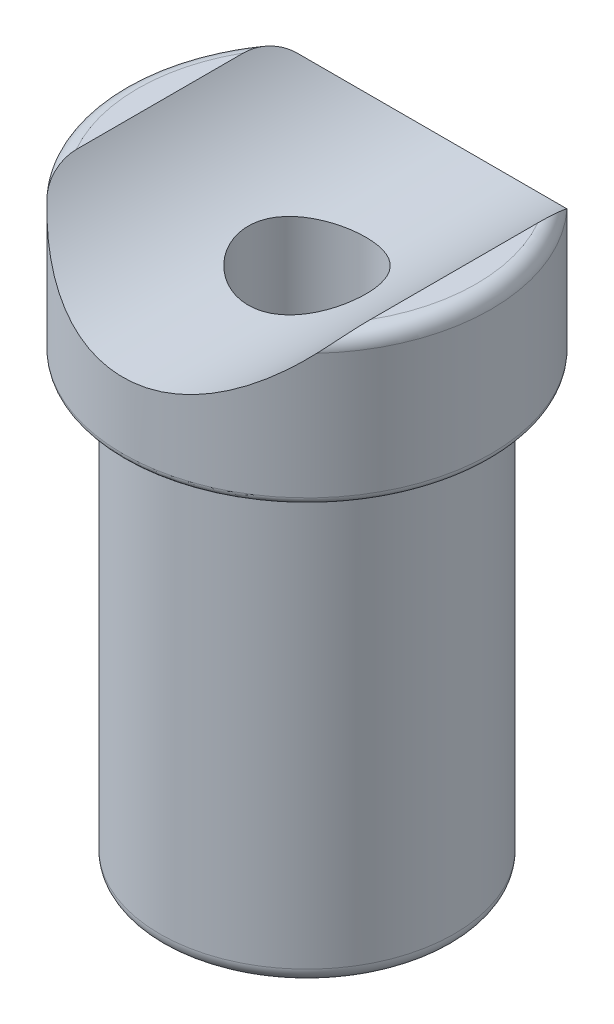
from build123d import *

# Parameters (mm, degrees)
CUT_EXTRUDE_1_DEPTH      = 38.436613095
CUT_EXTRUDE_1_DEPTH_BACK = 38.436613095
SKETCH_2_R               = 12.5
FILLET_1_R               = 1
FILLET_2_R               = 0.5
FILLET_3_R               = 1


with BuildPart() as part:
    # Эскиз1 → Повернуть1 (revolve)
    with BuildSketch(Plane.XY, mode=Mode.PRIVATE) as revolve_1_sk:
        Polygon((-4, 33), (-4, 16), (-7, 16), (-7, -7), (-10, -7), (-10, 23), (-12.5, 23), (-12.5, 33), align=None)
    revolve(revolve_1_sk.sketch.rotate(Axis((0, 98.834265919, 0), (0, -1, 0)), 270), axis=Axis((0, 98.834265919, 0), (0, -1, 0)))

    # Эскиз2 → Вырез-Вытянуть1 (cut, two sides: drawn at the far end of the back side and taken through both)
    with BuildSketch(Plane.XY.offset(-CUT_EXTRUDE_1_DEPTH_BACK)):
        with Locations((0, 40.5)):
            Circle(SKETCH_2_R)
    extrude(amount=CUT_EXTRUDE_1_DEPTH + CUT_EXTRUDE_1_DEPTH_BACK, mode=Mode.SUBTRACT)

    # Скругление1
    fillet_1_edges = [part.edges().sort_by_distance(p)[0] for p in [
        (12.5, 33, 0),
        (-12.5, 33, 0),
    ]]
    fillet(fillet_1_edges, radius=FILLET_1_R)

    # Скругление2
    fillet_2_edges = [part.edges().sort_by_distance(p)[0] for p in [
        (0, 23, -12.5),
    ]]
    fillet(fillet_2_edges, radius=FILLET_2_R)

    # Скругление3
    fillet_3_edges = [part.edges().sort_by_distance(p)[0] for p in [
        (0, -7, -10),
        (0, -7, -7),
    ]]
    fillet(fillet_3_edges, radius=FILLET_3_R)


solid = part.part
